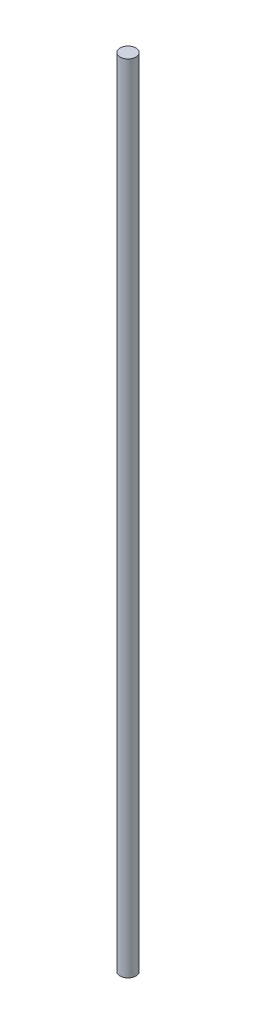
from build123d import *

# Parameters (mm, degrees)
SKETCH1_R           = 4
BOSS_EXTRUDE1_DEPTH = 400


with BuildPart() as part:
    # Sketch1 → Boss-Extrude1 (new body)
    with BuildSketch(Plane(origin=(0, 0, 0), x_dir=(1, 0, 0), z_dir=(0, 1, 0))):
        with Locations(Location((0, 0, 0), (0, 0, 270))):
            Circle(SKETCH1_R)
    extrude(amount=BOSS_EXTRUDE1_DEPTH)


solid = part.part
